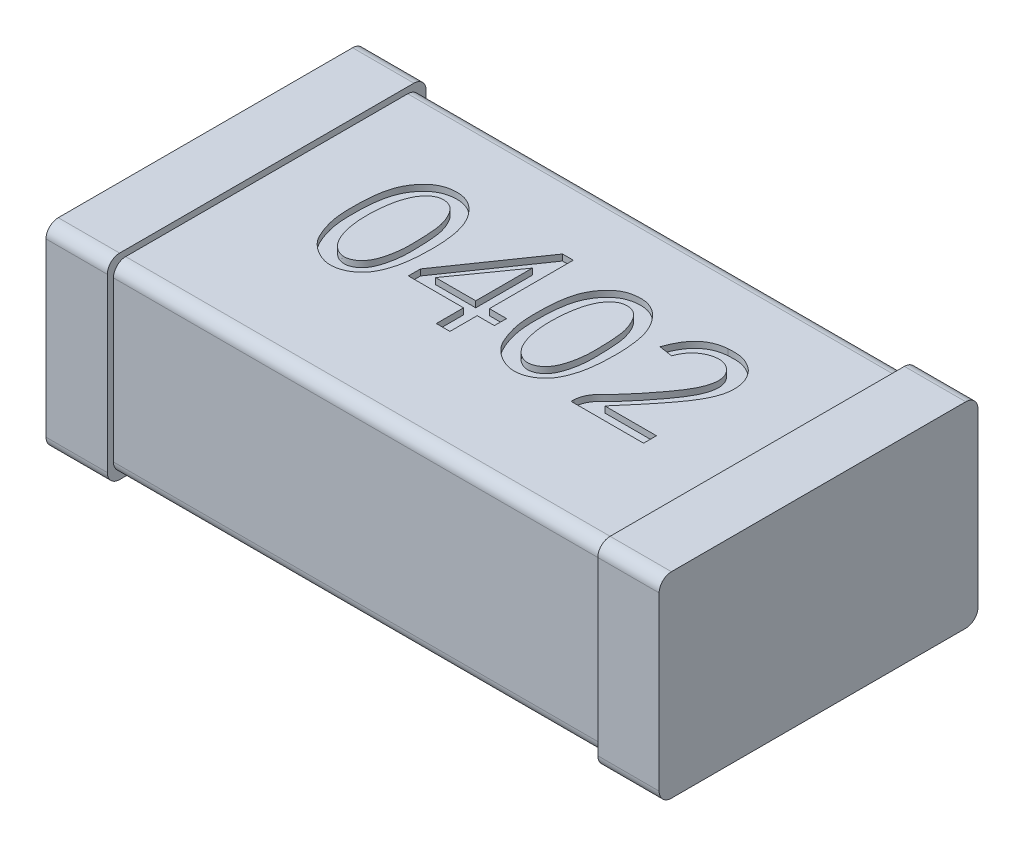
from build123d import *

# Parameters (mm, degrees)
SKETCH_1_W          = 1
SKETCH_1_H          = 0.5
EXTRUDE_1_DEPTH     = 0.3
SKETCH_2_W          = 0.52
SKETCH_2_H          = 0.32
EXTRUDE_2_DEPTH     = 0.1
SKETCH_3_W          = 0.52
SKETCH_3_H          = 0.32
EXTRUDE_3_DEPTH     = 0.1
CUT_EXTRUDE_1_DEPTH = 0.01
FILLET_1_R          = 0.02
FILLET_2_R          = 0.02


with BuildPart() as part:
    # 草图1 → 凸台-拉伸1 (new body)
    with BuildSketch(Plane(origin=(0, 0, 0), x_dir=(1, 0, 0), z_dir=(0, 1, 0))):
        Rectangle(SKETCH_1_W, SKETCH_1_H)
    extrude(amount=EXTRUDE_1_DEPTH)

    # 草图2 → 凸台-拉伸2 (add)
    with BuildSketch(Plane.ZY.offset(0.5)):
        with Locations((0, 0.15)):
            Rectangle(SKETCH_2_W, SKETCH_2_H)
    extrude(amount=-EXTRUDE_2_DEPTH)

    # 草图3 → 凸台-拉伸3 (add)
    with BuildSketch(Plane(origin=(0.5, 0, 0), x_dir=(0, 0, -1), z_dir=(1, 0, 0))):
        with Locations((0, 0.15)):
            Rectangle(SKETCH_3_W, SKETCH_3_H)
    extrude(amount=-EXTRUDE_3_DEPTH)

    # 草图4 → 切除-拉伸1 (cut)
    # profile 1 of 4: a face of its own
    with BuildSketch(Plane(origin=(0, 0.3, 0), x_dir=(1, 0, 0), z_dir=(0, 1, 0))):
        with BuildLine():
            add(Edge.make_bspline(
                [(-0.28495391, 0.040429461), (-0.284842534, 0.042943088), (-0.284625306, 0.047845698), (-0.283997688, 0.054994256), (-0.283239775, 0.061759764), (-0.282254388, 0.068121531), (-0.2810365, 0.074058383), (-0.279658, 0.079601433), (-0.278064926, 0.084735172), (-0.275719159, 0.09100497), (-0.272201568, 0.098221433), (-0.26717004, 0.106152841), (-0.261323237, 0.11328262), (-0.255791975, 0.118506843), (-0.250995997, 0.122183675), (-0.247164102, 0.124570922), (-0.243138334, 0.126610646), (-0.23890549, 0.128274084), (-0.234473356, 0.129513184), (-0.229853673, 0.130427999), (-0.225031193, 0.130993918), (-0.220061865, 0.131162285), (-0.215055093, 0.13092654), (-0.210136656, 0.130158548), (-0.20539045, 0.128795165), (-0.200813235, 0.126923456), (-0.196417467, 0.124518541), (-0.192181018, 0.121599739), (-0.188154114, 0.118091566), (-0.184286565, 0.11413647), (-0.180674162, 0.109783572), (-0.177365208, 0.10511688), (-0.174373449, 0.10018453), (-0.171738764, 0.094959463), (-0.169377081, 0.089487753), (-0.16739584, 0.083720661), (-0.165756704, 0.077681618), (-0.163951759, 0.069150411), (-0.162363798, 0.057833986), (-0.16124506, 0.043511718), (-0.160989781, 0.028240169), (-0.161369896, 0.015033405), (-0.162086421, 0.00433288), (-0.162901031, -0.003428344), (-0.163995193, -0.010794052), (-0.165268928, -0.017800095), (-0.166862448, -0.024409217), (-0.168750785, -0.030628498), (-0.17079105, -0.036498568), (-0.173192551, -0.041957722), (-0.175808163, -0.047052323), (-0.178790184, -0.051717111), (-0.182020787, -0.056015095), (-0.185585612, -0.059912214), (-0.189531103, -0.063329966), (-0.193719991, -0.06643327), (-0.198264771, -0.06907453), (-0.203044338, -0.071315897), (-0.207966932, -0.07309974), (-0.212971097, -0.074262395), (-0.217962432, -0.074953431), (-0.222976111, -0.074955959), (-0.227982428, -0.074520043), (-0.232960824, -0.07337334), (-0.237972706, -0.071796748), (-0.242883828, -0.069567148), (-0.247610668, -0.066999875), (-0.252059884, -0.064236719), (-0.256109885, -0.061230008), (-0.259793032, -0.058019089), (-0.263155271, -0.054630921), (-0.266156922, -0.051033338), (-0.268766829, -0.04721638), (-0.271683353, -0.041844519), (-0.274807882, -0.034915468), (-0.278041751, -0.026380543), (-0.280684804, -0.01764032), (-0.282384341, -0.010129395), (-0.283504843, -0.003845931), (-0.284121346, 0.001304946), (-0.284656871, 0.006849661), (-0.284980527, 0.012789508), (-0.285195813, 0.019129637), (-0.285289508, 0.025874563), (-0.285189223, 0.033023502), (-0.285033733, 0.037917224), (-0.28495391, 0.040429461)],
                knots=[0, 0, 0, 0, 1.18043416, 2.302333746, 3.366253517, 4.374302266, 5.321670991, 6.208995316, 7.053297808, 7.84229274, 9.348259463, 10.810477328, 12.240076564, 13.663562249, 14.3695339, 15.072606272, 15.778577923, 16.484387009, 17.202829605, 17.934942377, 18.692112664, 19.478485278, 20.265441384, 21.040673806, 21.808439453, 22.577161074, 23.356320991, 24.155029842, 24.986154494, 25.858111265, 26.748121484, 27.637306138, 28.540117759, 29.452135788, 30.380885827, 31.334339875, 32.310628684, 33.31521083, 35.42407972, 37.666773946, 40.052062172, 42.587025658, 43.863776122, 45.083322308, 46.247467896, 47.357025429, 48.423487632, 49.435172604, 50.405897663, 51.337337341, 52.231284254, 53.090220275, 53.931690991, 54.751583713, 55.562922169, 56.377338113, 57.194202079, 58.024663732, 58.851830165, 59.645552351, 60.431282623, 61.21044254, 61.99312915, 62.783838437, 63.60230231, 64.454612977, 65.309477934, 66.125301685, 66.909862715, 67.67340185, 68.415973016, 69.147238889, 69.868837108, 70.581506411, 72.0124375, 73.431838244, 74.861437481, 76.292961888, 77.042577341, 77.855187732, 78.726196438, 79.655959089, 80.645695907, 81.702690171, 82.820655125, 84, 84, 84, 84], degree=3))
        make_face()
        with BuildLine():
            add(Edge.make_bspline(
                [(-0.260392506, 0.047447005), (-0.260658041, 0.044806289), (-0.261181153, 0.039603987), (-0.261608995, 0.031886474), (-0.261730918, 0.024387426), (-0.261619269, 0.017103813), (-0.261188699, 0.010049884), (-0.260454073, 0.00321199), (-0.25940762, -0.003405071), (-0.258126854, -0.00978375), (-0.256592321, -0.015822097), (-0.254772487, -0.021438072), (-0.252701077, -0.026590764), (-0.250409612, -0.031287934), (-0.247894284, -0.03553519), (-0.245108254, -0.039308413), (-0.242129687, -0.042687874), (-0.238869569, -0.045527911), (-0.235525843, -0.047912928), (-0.232107256, -0.049766065), (-0.228669562, -0.051079198), (-0.225199642, -0.051882105), (-0.221710001, -0.052138468), (-0.218199248, -0.051890143), (-0.214693353, -0.051023425), (-0.21120973, -0.049695057), (-0.207848325, -0.047865476), (-0.204668318, -0.045656248), (-0.201736014, -0.043017958), (-0.199049862, -0.039978923), (-0.196625221, -0.036520345), (-0.194406719, -0.032701353), (-0.192458705, -0.028458603), (-0.190168009, -0.02224646), (-0.187861059, -0.01397355), (-0.185808628, -0.003635842), (-0.184598054, 0.00714504), (-0.184280654, 0.018206221), (-0.184487027, 0.029196872), (-0.184734546, 0.039843771), (-0.185329713, 0.04996702), (-0.186042011, 0.059618167), (-0.187250846, 0.068840302), (-0.189478567, 0.077585122), (-0.192598951, 0.085876339), (-0.195801688, 0.092421411), (-0.1988711, 0.097172396), (-0.201290789, 0.10036017), (-0.203980867, 0.103023938), (-0.206817398, 0.105294816), (-0.209866366, 0.107023682), (-0.213100198, 0.108316915), (-0.216517483, 0.109118342), (-0.220066431, 0.10951351), (-0.223641875, 0.109444429), (-0.227153824, 0.108816872), (-0.230560059, 0.107719361), (-0.233882012, 0.10615692), (-0.237049987, 0.1040422), (-0.24011462, 0.10145398), (-0.243041387, 0.098348677), (-0.245924442, 0.094810569), (-0.248554289, 0.090702135), (-0.250986432, 0.086099917), (-0.253143291, 0.080944783), (-0.255074981, 0.075266571), (-0.256809826, 0.069065587), (-0.25826848, 0.062338102), (-0.259478906, 0.055078753), (-0.260081031, 0.050048908), (-0.260392506, 0.047447005)],
                knots=[0, 0, 0, 0, 1.378198314, 2.715098627, 4.012594964, 5.272602849, 6.497213731, 7.681415101, 8.842769074, 9.975170128, 11.059162755, 12.076494648, 13.038717388, 13.940857576, 14.788360499, 15.598271168, 16.373595835, 17.122768248, 17.838466736, 18.502782022, 19.136468245, 19.744060339, 20.345653328, 20.947246317, 21.563841626, 22.214212994, 22.87852828, 23.546305104, 24.220743313, 24.921956094, 25.648106704, 26.41081768, 27.212668989, 28.069279432, 29.84713992, 31.666334073, 33.537864714, 35.473745168, 37.408579624, 39.246547954, 41.003985019, 42.674193204, 44.272363647, 45.827394737, 47.348405091, 48.867584295, 49.599750274, 50.283750763, 50.94125936, 51.560811542, 52.165388272, 52.754418158, 53.363720025, 53.982318455, 54.604903792, 55.213928724, 55.828148287, 56.458765578, 57.113918044, 57.800421407, 58.537638978, 59.326979919, 60.167286366, 61.066273245, 62.027297208, 63.065989643, 64.179487018, 65.369443928, 66.639232213, 68, 68, 68, 68], degree=3))
        make_face(mode=Mode.SUBTRACT)
    # profile 2 of 4: a face of its own
    with BuildSketch(Plane(origin=(0, 0.3, 0), x_dir=(1, 0, 0), z_dir=(0, 1, 0))):
        with BuildLine():
            add(Edge.make_bspline(
                [(0.014461295, 0.040429461), (0.01457267, 0.042943088), (0.014789899, 0.047845698), (0.015417517, 0.054994256), (0.01617543, 0.061759764), (0.017160816, 0.068121531), (0.018378705, 0.074058383), (0.019757205, 0.079601433), (0.021350278, 0.084735172), (0.023696046, 0.09100497), (0.027213637, 0.098221433), (0.032245165, 0.106152841), (0.038091968, 0.11328262), (0.04362323, 0.118506843), (0.048419208, 0.122183675), (0.052251103, 0.124570922), (0.056276871, 0.126610646), (0.060509714, 0.128274084), (0.064941849, 0.129513184), (0.069561532, 0.130427999), (0.074384012, 0.130993918), (0.079353339, 0.131162285), (0.084360112, 0.13092654), (0.089278549, 0.130158548), (0.094024754, 0.128795165), (0.09860197, 0.126923456), (0.102997738, 0.124518541), (0.107234186, 0.121599739), (0.111261091, 0.118091566), (0.115128639, 0.11413647), (0.118741043, 0.109783572), (0.122049997, 0.10511688), (0.125041755, 0.10018453), (0.127676441, 0.094959463), (0.130038123, 0.089487753), (0.132019365, 0.083720661), (0.133658501, 0.077681618), (0.135463446, 0.069150411), (0.137051406, 0.057833986), (0.138170145, 0.043511718), (0.138425424, 0.028240169), (0.138045309, 0.015033405), (0.137328784, 0.00433288), (0.136514174, -0.003428344), (0.135420012, -0.010794052), (0.134146277, -0.017800095), (0.132552757, -0.024409217), (0.130664419, -0.030628498), (0.128624155, -0.036498568), (0.126222654, -0.041957722), (0.123607042, -0.047052323), (0.120625021, -0.051717111), (0.117394418, -0.056015095), (0.113829593, -0.059912214), (0.109884101, -0.063329966), (0.105695213, -0.06643327), (0.101150433, -0.06907453), (0.096370866, -0.071315897), (0.091448273, -0.07309974), (0.086444108, -0.074262395), (0.081452772, -0.074953431), (0.076439094, -0.074955959), (0.071432776, -0.074520043), (0.066454381, -0.07337334), (0.061442499, -0.071796748), (0.056531377, -0.069567148), (0.051804537, -0.066999875), (0.047355321, -0.064236719), (0.04330532, -0.061230008), (0.039622173, -0.058019089), (0.036259934, -0.054630921), (0.033258283, -0.051033338), (0.030648376, -0.04721638), (0.027731852, -0.041844519), (0.024607323, -0.034915468), (0.021373453, -0.026380543), (0.0187304, -0.01764032), (0.017030864, -0.010129395), (0.015910361, -0.003845931), (0.015293859, 0.001304946), (0.014758334, 0.006849661), (0.014434678, 0.012789508), (0.014219392, 0.019129637), (0.014125696, 0.025874563), (0.014225981, 0.033023502), (0.014381472, 0.037917224), (0.014461295, 0.040429461)],
                knots=[0, 0, 0, 0, 1.18043416, 2.302333746, 3.366253517, 4.374302266, 5.321670991, 6.208995316, 7.053297808, 7.84229274, 9.348259463, 10.810477328, 12.240076564, 13.663562249, 14.3695339, 15.072606272, 15.778577923, 16.484387009, 17.202829605, 17.934942377, 18.692112664, 19.478485278, 20.265441384, 21.040673806, 21.808439453, 22.577161074, 23.356320991, 24.155029842, 24.986154494, 25.858111265, 26.748121484, 27.637306138, 28.540117759, 29.452135788, 30.380885827, 31.334339875, 32.310628684, 33.31521083, 35.42407972, 37.666773946, 40.052062172, 42.587025658, 43.863776122, 45.083322308, 46.247467896, 47.357025429, 48.423487632, 49.435172604, 50.405897663, 51.337337341, 52.231284254, 53.090220275, 53.931690991, 54.751583713, 55.562922169, 56.377338113, 57.194202079, 58.024663732, 58.851830165, 59.645552351, 60.431282623, 61.21044254, 61.99312915, 62.783838437, 63.60230231, 64.454612977, 65.309477934, 66.125301685, 66.909862715, 67.67340185, 68.415973016, 69.147238889, 69.868837108, 70.581506411, 72.0124375, 73.431838244, 74.861437481, 76.292961888, 77.042577341, 77.855187732, 78.726196438, 79.655959089, 80.645695907, 81.702690171, 82.820655125, 84, 84, 84, 84], degree=3))
        make_face()
        with BuildLine():
            add(Edge.make_bspline(
                [(0.039022698, 0.047447005), (0.038757164, 0.044806289), (0.038234052, 0.039603987), (0.03780621, 0.031886474), (0.037684287, 0.024387426), (0.037795935, 0.017103813), (0.038226506, 0.010049884), (0.038961132, 0.00321199), (0.040007584, -0.003405071), (0.04128835, -0.00978375), (0.042822884, -0.015822097), (0.044642718, -0.021438072), (0.046714127, -0.026590764), (0.049005593, -0.031287934), (0.051520921, -0.03553519), (0.054306951, -0.039308413), (0.057285518, -0.042687874), (0.060545636, -0.045527911), (0.063889362, -0.047912928), (0.067307949, -0.049766065), (0.070745642, -0.051079198), (0.074215563, -0.051882105), (0.077705204, -0.052138468), (0.081215957, -0.051890143), (0.084721852, -0.051023425), (0.088205475, -0.049695057), (0.09156688, -0.047865476), (0.094746886, -0.045656248), (0.097679191, -0.043017958), (0.100365343, -0.039978923), (0.102789983, -0.036520345), (0.105008486, -0.032701353), (0.106956499, -0.028458603), (0.109247196, -0.02224646), (0.111554146, -0.01397355), (0.113606577, -0.003635842), (0.11481715, 0.00714504), (0.11513455, 0.018206221), (0.114928177, 0.029196872), (0.114680659, 0.039843771), (0.114085491, 0.04996702), (0.113373194, 0.059618167), (0.112164359, 0.068840302), (0.109936637, 0.077585122), (0.106816253, 0.085876339), (0.103613517, 0.092421411), (0.100544105, 0.097172396), (0.098124415, 0.10036017), (0.095434338, 0.103023938), (0.092597807, 0.105294816), (0.089548839, 0.107023682), (0.086315006, 0.108316915), (0.082897722, 0.109118342), (0.079348774, 0.10951351), (0.07577333, 0.109444429), (0.072261381, 0.108816872), (0.068855146, 0.107719361), (0.065533192, 0.10615692), (0.062365218, 0.1040422), (0.059300584, 0.10145398), (0.056373817, 0.098348677), (0.053490763, 0.094810569), (0.050860916, 0.090702135), (0.048428772, 0.086099917), (0.046271913, 0.080944783), (0.044340223, 0.075266571), (0.042605379, 0.069065587), (0.041146724, 0.062338102), (0.039936299, 0.055078753), (0.039334173, 0.050048908), (0.039022698, 0.047447005)],
                knots=[0, 0, 0, 0, 1.378198314, 2.715098627, 4.012594964, 5.272602849, 6.497213731, 7.681415101, 8.842769074, 9.975170128, 11.059162755, 12.076494648, 13.038717388, 13.940857576, 14.788360499, 15.598271168, 16.373595835, 17.122768248, 17.838466736, 18.502782022, 19.136468245, 19.744060339, 20.345653328, 20.947246317, 21.563841626, 22.214212994, 22.87852828, 23.546305104, 24.220743313, 24.921956094, 25.648106704, 26.41081768, 27.212668989, 28.069279432, 29.84713992, 31.666334073, 33.537864714, 35.473745168, 37.408579624, 39.246547954, 41.003985019, 42.674193204, 44.272363647, 45.827394737, 47.348405091, 48.867584295, 49.599750274, 50.283750763, 50.94125936, 51.560811542, 52.165388272, 52.754418158, 53.363720025, 53.982318455, 54.604903792, 55.213928724, 55.828148287, 56.458765578, 57.113918044, 57.800421407, 58.537638978, 59.326979919, 60.167286366, 61.066273245, 62.027297208, 63.065989643, 64.179487018, 65.369443928, 66.639232213, 68, 68, 68, 68], degree=3))
        make_face(mode=Mode.SUBTRACT)
    # profile 3 of 4: a face of its own
    with BuildSketch(Plane(origin=(0, 0.3, 0), x_dir=(1, 0, 0), z_dir=(0, 1, 0))):
        Polygon((-0.052205372, -0.026800342), (-0.142263852, -0.026800342), (-0.142263852, -0.006917301), (-0.047527009, 0.129924804), (-0.02998315, 0.129924804), (-0.02998315, -0.006917301), (-0.001912974, -0.006917301), (-0.001912974, -0.026800342), (-0.02998315, -0.026800342), (-0.02998315, -0.071244786), (-0.052205372, -0.071244786), align=None)
        Polygon((-0.052205372, -0.006917301), (-0.052205372, 0.08548036), (-0.117702448, -0.006917301), align=None, mode=Mode.SUBTRACT)
    # profile 4 of 4: a face of its own
    with BuildSketch(Plane(origin=(0, 0.3, 0), x_dir=(1, 0, 0), z_dir=(0, 1, 0))):
        with BuildLine():
            add(Edge.make_bspline(
                [(0.167677669, -0.066566424), (0.167819152, -0.065117686), (0.168100357, -0.062238247), (0.169087783, -0.058002215), (0.170477164, -0.053866347), (0.172305054, -0.049832496), (0.174562028, -0.045899028), (0.177338163, -0.042149222), (0.180438207, -0.038417807), (0.18414559, -0.034890973), (0.188142973, -0.031138417), (0.192283403, -0.02684315), (0.196768062, -0.022153759), (0.201415239, -0.016870399), (0.206421147, -0.011183063), (0.211593233, -0.004923711), (0.217055027, 0.001787941), (0.222653255, 0.008827104), (0.228139326, 0.015897079), (0.233194892, 0.02274894), (0.237792521, 0.029146683), (0.241895109, 0.035112897), (0.245393338, 0.040716313), (0.248431213, 0.045869976), (0.251023326, 0.050564569), (0.253610004, 0.056171474), (0.256051312, 0.062637711), (0.257965559, 0.069983544), (0.258835422, 0.076782014), (0.258493459, 0.083029352), (0.257150599, 0.08873049), (0.254804391, 0.093902754), (0.251511842, 0.098564518), (0.247302315, 0.102541504), (0.242503965, 0.105815746), (0.237164245, 0.108015691), (0.231450795, 0.10912749), (0.225473471, 0.109026902), (0.219448549, 0.107955745), (0.21344644, 0.106093883), (0.207660346, 0.103211019), (0.201991837, 0.099614538), (0.196739911, 0.094981183), (0.192123756, 0.089275398), (0.188196871, 0.082526247), (0.186237739, 0.077540285), (0.185221529, 0.074954044)],
                knots=[0, 0, 0, 0, 0.683264685, 1.358023177, 2.0380809, 2.730345762, 3.435487858, 4.164189287, 4.919895072, 5.711413948, 6.565494804, 7.49616148, 8.513531843, 9.613812574, 10.80147361, 12.073102873, 13.428218159, 14.866997124, 16.298560904, 17.632315587, 18.867297526, 20.000038836, 21.033387935, 21.969994494, 22.810824564, 23.551397478, 24.869445784, 26.052467085, 27.111050094, 28.075902372, 28.975949733, 29.847314516, 30.728213316, 31.639844513, 32.554273251, 33.442456201, 34.333871785, 35.270085163, 36.233696473, 37.201335111, 38.211692251, 39.261697588, 40.347896805, 41.485826765, 42.695887429, 44, 44, 44, 44], degree=3))
            Line((0.185221529, 0.074954044), (0.162999306, 0.078462816))
            add(Edge.make_bspline(
                [(0.162999306, 0.078462816), (0.163783886, 0.080638141), (0.165310338, 0.084870377), (0.167938835, 0.090896877), (0.170654134, 0.096506765), (0.173530765, 0.10166287), (0.176631135, 0.106328389), (0.179880045, 0.11054868), (0.183291973, 0.114323177), (0.186880035, 0.117647465), (0.19063191, 0.120577986), (0.194573362, 0.123119428), (0.198655315, 0.125339446), (0.202893825, 0.127223543), (0.207298046, 0.12874194), (0.211887559, 0.129846138), (0.216615423, 0.130702775), (0.219843824, 0.130962738), (0.221478839, 0.131094395)],
                knots=[0, 0, 0, 0, 1.318688324, 2.565594597, 3.747971738, 4.872722892, 5.930337296, 6.940181326, 7.908044283, 8.828858542, 9.726735078, 10.619953387, 11.500744836, 12.374616489, 13.262770363, 14.15366946, 15.064931369, 16, 16, 16, 16], degree=3))
            add(Edge.make_bspline(
                [(0.221478839, 0.131094395), (0.223383485, 0.131247155), (0.227087653, 0.131544243), (0.232516829, 0.13160018), (0.237640482, 0.131245823), (0.242549268, 0.130572835), (0.247344897, 0.129383147), (0.252150906, 0.127627675), (0.257012747, 0.12525496), (0.261922511, 0.122344797), (0.266735232, 0.11878234), (0.271092401, 0.114302744), (0.274937422, 0.108992737), (0.278372852, 0.10298583), (0.281145799, 0.096232252), (0.282813449, 0.088709786), (0.283424975, 0.080549698), (0.283088959, 0.073351955), (0.282270444, 0.067261307), (0.281123615, 0.062393549), (0.279470841, 0.057326202), (0.277524882, 0.051980782), (0.27494086, 0.046484051), (0.272032358, 0.040718017), (0.268554248, 0.034787217), (0.265397889, 0.0296633), (0.262538193, 0.025397057), (0.260142948, 0.021915772), (0.257526276, 0.018199662), (0.25458928, 0.014307812), (0.25148744, 0.010150987), (0.248150871, 0.005765095), (0.244550529, 0.00118816), (0.240728062, -0.003637828), (0.236666209, -0.008699998), (0.232346638, -0.013969016), (0.227770542, -0.01943303), (0.223009132, -0.025166085), (0.218004429, -0.031120127), (0.2127526, -0.037289547), (0.207236301, -0.043646543), (0.203500501, -0.047981811), (0.201595798, -0.050192155)],
                knots=[0, 0, 0, 0, 0.924262298, 1.797511285, 2.623724224, 3.407158757, 4.191620419, 5.009283641, 5.877881841, 6.805175164, 7.767818098, 8.765683208, 9.814991193, 10.931884262, 12.107176208, 13.332417047, 14.642951659, 16.055476784, 16.810263112, 17.613474593, 18.470705512, 19.388078144, 20.363412498, 21.406914204, 22.511682051, 23.688322701, 24.318011351, 24.996206783, 25.732766533, 26.516574724, 27.354866926, 28.242087009, 29.182574856, 30.172115786, 31.220563025, 32.322544456, 33.468316952, 34.668650042, 35.928027342, 37.231299145, 38.588373428, 40, 40, 40, 40], degree=3))
            Line((0.201595798, -0.050192155), (0.285806324, -0.050192155))
            Line((0.285806324, -0.050192155), (0.285806324, -0.071244786))
            Line((0.285806324, -0.071244786), (0.167677669, -0.071244786))
            Line((0.167677669, -0.071244786), (0.167677669, -0.066566424))
        make_face()
    extrude(amount=-CUT_EXTRUDE_1_DEPTH, mode=Mode.SUBTRACT)

    # 圆角1
    fillet_1_edges = [part.edges().sort_by_distance(p)[0] for p in [
        (0, 0, 0.25),
        (0, 0.3, 0.25),
        (0, 0, -0.25),
        (0, 0.3, -0.25),
    ]]
    fillet(fillet_1_edges, radius=FILLET_1_R)

    # 圆角2
    fillet_2_edges = [part.edges().sort_by_distance(p)[0] for p in [
        (-0.45, -0.01, -0.26),
        (-0.45, 0.31, -0.26),
        (-0.45, 0.31, 0.26),
        (-0.45, -0.01, 0.26),
        (0.45, -0.01, 0.26),
        (0.45, 0.31, 0.26),
        (0.45, 0.31, -0.26),
        (0.45, -0.01, -0.26),
    ]]
    fillet(fillet_2_edges, radius=FILLET_2_R)


solid = part.part
